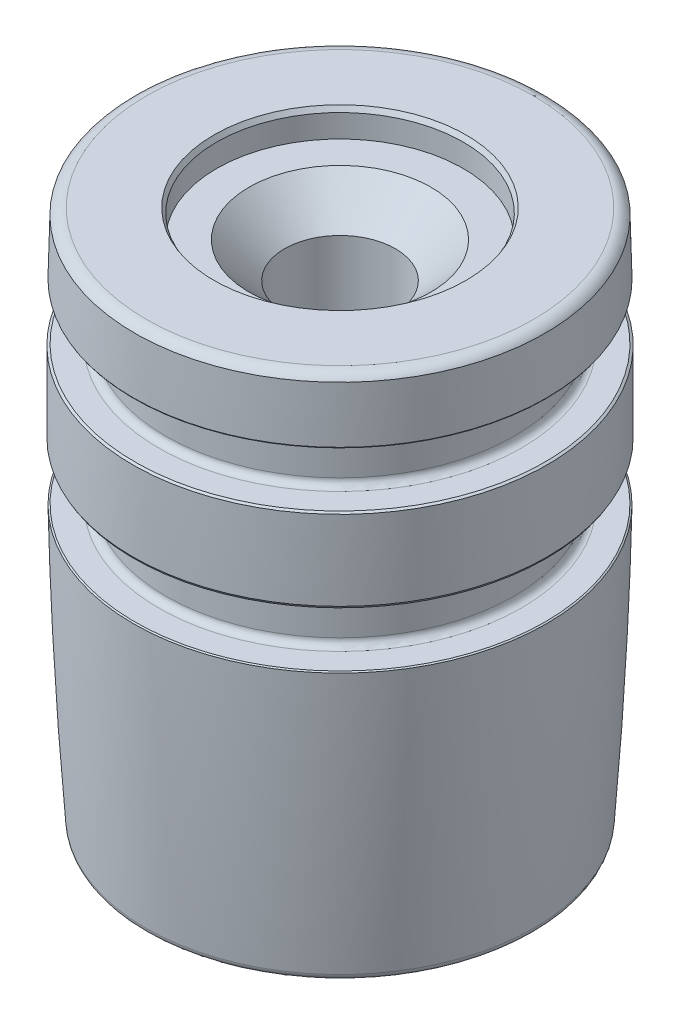
from build123d import *
from OCP.BRepFilletAPI import BRepFilletAPI_MakeChamfer

# Parameters (mm, degrees)
FILLET1_R      = 1
CHAMFER1_SIZE  = 0.2
CHAMFER1_SIZE2 = 0.346410162
CHAMFER2_SIZE  = 0.1
CHAMFER2_SIZE2 = 0.173205081
FILLET2_R      = 0.5
CHAMFER3_SIZE  = 0.4
CHAMFER3_SIZE2 = 0.692820323
FILLET3_R      = 0.5


with BuildPart() as part:
    # Sketch1 → Revolve1 (revolve)
    with BuildSketch(Plane.XY):
        Polygon((-8.9, 0), (-14.975, 0), (-14.975, -4.5), (-12.575, -4.5), (-12.575, -8.5), (-14.975, -8.5), (-14.975, -14.5), (-12.575, -14.5), (-12.575, -18.5), (-14.975, -18.5), (-14.975, -38.5), (-9.535, -38.5), (-9.535, -22.5), (-4, -22.5), (-4, -4.565685425), (-6.565685425, -2), (-8.9, -2), align=None)
    revolve(axis=Axis((0, 0, 0), (0, -1, 0)))

    # Fillet1
    fillet1_edges = [part.edges().sort_by_distance(p)[0] for p in [
        (14.975, -38.5, 0),
        (14.975, 0, 0),
    ]]
    fillet(fillet1_edges, radius=FILLET1_R)

    # Chamfer1
    chamfer1_edges = [part.edges().sort_by_distance(p)[0] for p in [
        (8.9, 0, 0),
    ]]
    chamfer1_side = [part.faces().sort_by_distance(p)[0] for p in [
        (13.579727309, 0, 0),
    ]]
    chamfer(chamfer1_edges, length=CHAMFER1_SIZE, length2=CHAMFER1_SIZE2, reference=chamfer1_side[0])

    # Chamfer2: one chamfer whose edges measure the first distance from different faces: ONE call of the kernel's chamfer builder (chamfer() names one face for all edges)
    chamfer2_edges_1 = [part.edges().sort_by_distance(p)[0] for p in [
        (14.975, -18.5, 0),
    ]]
    chamfer2_side_1 = [part.faces().sort_by_distance(p)[0] for p in [
        (14.975, -28, 0),
    ]]
    chamfer2_edges_2 = [part.edges().sort_by_distance(p)[0] for p in [
        (14.975, -14.5, 0),
    ]]
    chamfer2_side_2 = [part.faces().sort_by_distance(p)[0] for p in [
        (14.551443038, -14.5, 0),
    ]]
    chamfer2_edges_3 = [part.edges().sort_by_distance(p)[0] for p in [
        (14.975, -8.5, 0),
    ]]
    chamfer2_side_3 = [part.faces().sort_by_distance(p)[0] for p in [
        (14.975, -11.5, 0),
    ]]
    chamfer2_edges_4 = [part.edges().sort_by_distance(p)[0] for p in [
        (14.975, -4.5, 0),
    ]]
    chamfer2_side_4 = [part.faces().sort_by_distance(p)[0] for p in [
        (14.551443038, -4.5, 0),
    ]]
    chamfer2 = BRepFilletAPI_MakeChamfer(part.part.solid().wrapped)
    for e in chamfer2_edges_1:
        chamfer2.Add(CHAMFER2_SIZE, CHAMFER2_SIZE2, e.wrapped, chamfer2_side_1[0].wrapped)  # the first distance lies on this face
    for e in chamfer2_edges_2:
        chamfer2.Add(CHAMFER2_SIZE, CHAMFER2_SIZE2, e.wrapped, chamfer2_side_2[0].wrapped)  # the first distance lies on this face
    for e in chamfer2_edges_3:
        chamfer2.Add(CHAMFER2_SIZE, CHAMFER2_SIZE2, e.wrapped, chamfer2_side_3[0].wrapped)  # the first distance lies on this face
    for e in chamfer2_edges_4:
        chamfer2.Add(CHAMFER2_SIZE, CHAMFER2_SIZE2, e.wrapped, chamfer2_side_4[0].wrapped)  # the first distance lies on this face
    add(Compound.cast(chamfer2.Shape()), mode=Mode.REPLACE)

    # Fillet2
    fillet2_edges = [part.edges().sort_by_distance(p)[0] for p in [
        (12.575, -18.5, 0),
        (12.575, -14.5, 0),
        (12.575, -8.5, 0),
        (12.575, -4.5, 0),
    ]]
    fillet(fillet2_edges, radius=FILLET2_R)

    # Chamfer3: one chamfer whose edges measure the first distance from different faces: ONE call of the kernel's chamfer builder (chamfer() names one face for all edges)
    chamfer3_edges_1 = [part.edges().sort_by_distance(p)[0] for p in [
        (4, -22.5, 0),
    ]]
    chamfer3_side_1 = [part.faces().sort_by_distance(p)[0] for p in [
        (4, -13.532842712, 0),
    ]]
    chamfer3_edges_2 = [part.edges().sort_by_distance(p)[0] for p in [
        (9.535, -38.5, 0),
    ]]
    chamfer3_side_2 = [part.faces().sort_by_distance(p)[0] for p in [
        (9.535, -30.5, 0),
    ]]
    chamfer3 = BRepFilletAPI_MakeChamfer(part.part.solid().wrapped)
    for e in chamfer3_edges_1:
        chamfer3.Add(CHAMFER3_SIZE, CHAMFER3_SIZE2, e.wrapped, chamfer3_side_1[0].wrapped)  # the first distance lies on this face
    for e in chamfer3_edges_2:
        chamfer3.Add(CHAMFER3_SIZE, CHAMFER3_SIZE2, e.wrapped, chamfer3_side_2[0].wrapped)  # the first distance lies on this face
    add(Compound.cast(chamfer3.Shape()), mode=Mode.REPLACE)

    # Sketch2 → Cut-Revolve1 (revolve, cut)
    with BuildSketch(Plane.XY, mode=Mode.PRIVATE) as cut_revolve1_sk:
        with BuildLine():
            Line((-13.734468766, 18.644782515), (-23.700977144, 18.644782515))
            Line((-23.700977144, 18.644782515), (-23.700977144, -42.807189117))
            Line((-23.700977144, -42.807189117), (-13.975, -38.5))
            ThreePointArc((-13.975, -38.5), (-14.971757933, -9.922907018), (-13.734468766, 18.644782515))
        make_face()
    revolve(cut_revolve1_sk.sketch.rotate(Axis((0, -0.346410162, 0), (0, 1, 0)), 180), axis=Axis((0, -0.346410162, 0), (0, 1, 0)), mode=Mode.SUBTRACT)

    # Fillet3
    fillet3_edges = [part.edges().sort_by_distance(p)[0] for p in [
        (-13.975, -38.5, 0),
    ]]
    fillet(fillet3_edges, radius=FILLET3_R)


solid = part.part
